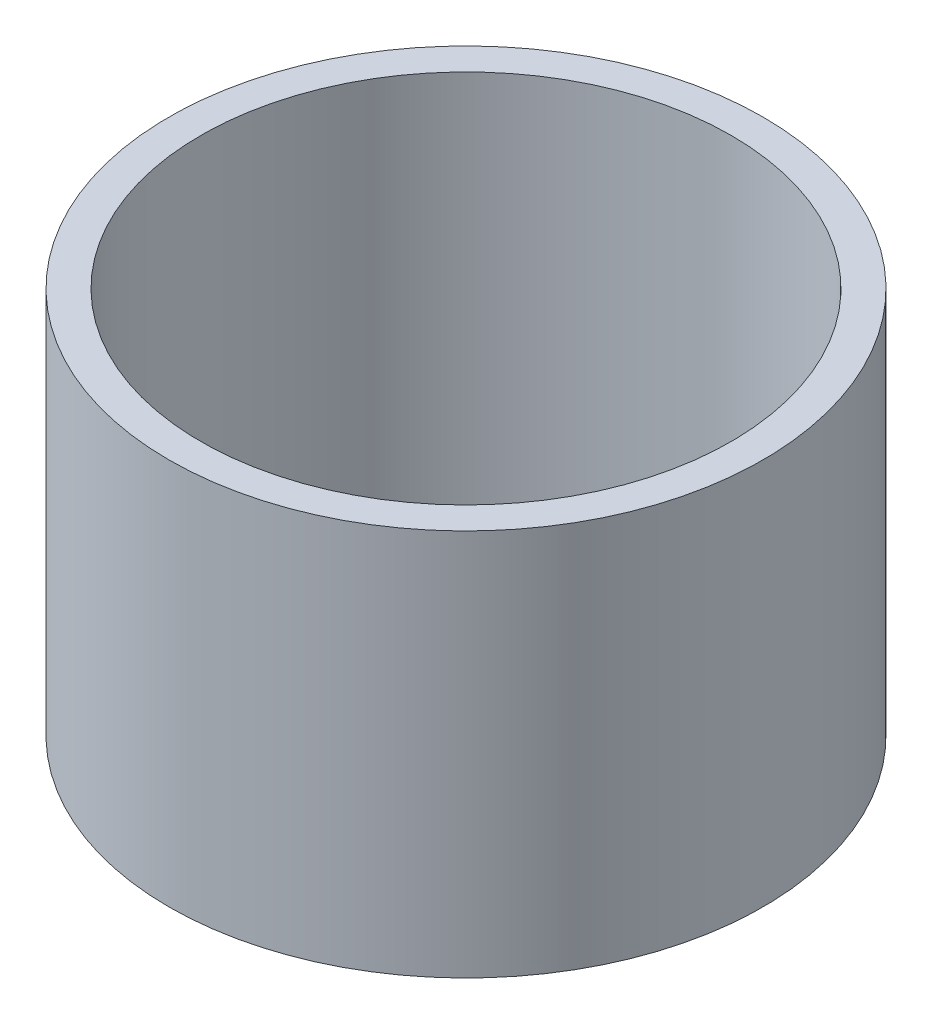
from build123d import *

# Parameters (mm, degrees)
SKETCH1_W = 1.5
SKETCH1_H = 18.25


with BuildPart() as part:
    # Sketch1 → Revolve1 (revolve)
    with BuildSketch(Plane.XY, mode=Mode.PRIVATE) as revolve1_sk:
        with Locations((-13.25, -9.125)):
            Rectangle(SKETCH1_W, SKETCH1_H)
    revolve(revolve1_sk.sketch.rotate(Axis((0, -8.952616861, 0), (0, 1, 0)), 270), axis=Axis((0, -8.952616861, 0), (0, 1, 0)))


solid = part.part
